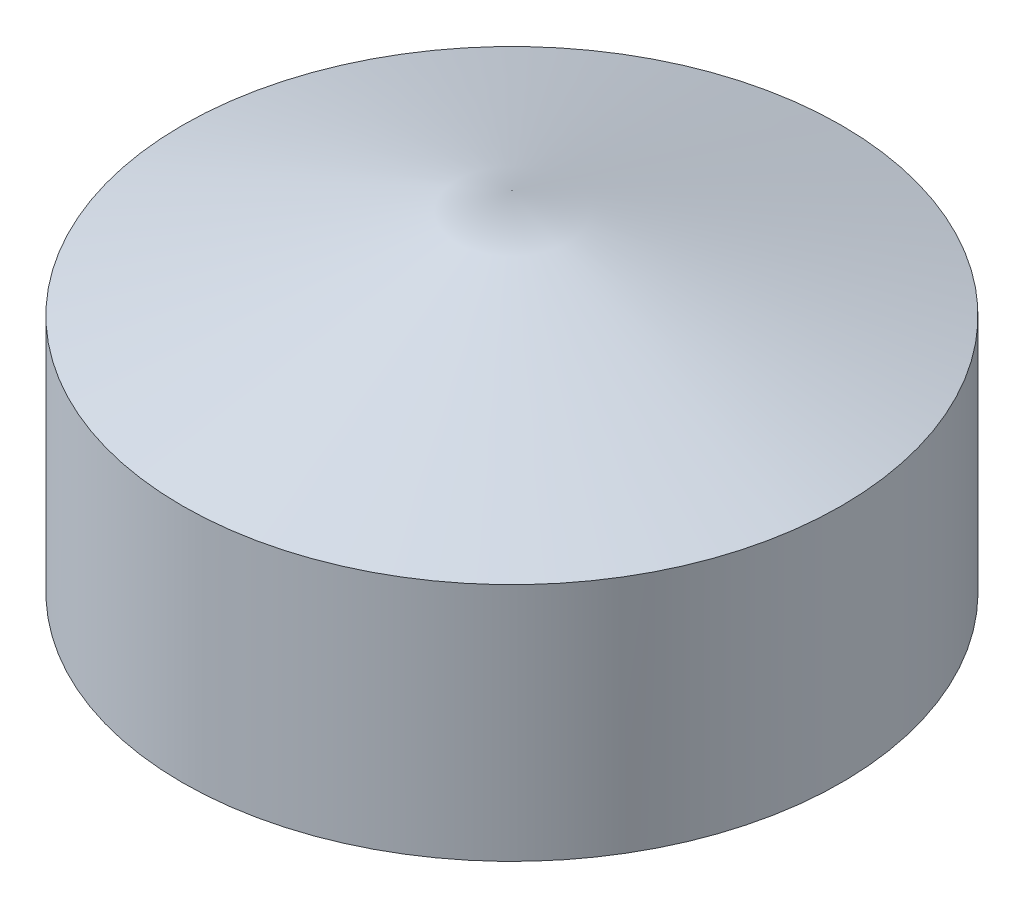
from build123d import *

# Parameters (mm, degrees)
IZIM1_R                     = 11
IZIM1_R_2                   = 10
Y_KSEKLIK_EKSTR_ZYON1_DEPTH = 8


with BuildPart() as part:
    # Çizim1 → Yükseklik-Ekstrüzyon1 (new body)
    with BuildSketch(Plane(origin=(0, 0, 0), x_dir=(1, 0, 0), z_dir=(0, 1, 0))):
        with Locations(Location((0, 0, 0), (0, 0, 270))):
            Circle(IZIM1_R)
        with Locations(Location((0, 0, 0), (0, 0, 270))):
            Circle(IZIM1_R_2, mode=Mode.SUBTRACT)
    extrude(amount=Y_KSEKLIK_EKSTR_ZYON1_DEPTH)

    # Çizim2 → Döndür1 (revolve)
    with BuildSketch(Plane.XY, mode=Mode.PRIVATE) as d_nd_r1_sk:
        Polygon((0, 11.612653039), (11, 8), (0, 8), align=None)
    revolve(d_nd_r1_sk.sketch.rotate(Axis((0, 11.612653039, 0), (0, -1, 0)), 270), axis=Axis((0, 11.612653039, 0), (0, -1, 0)))


solid = part.part
